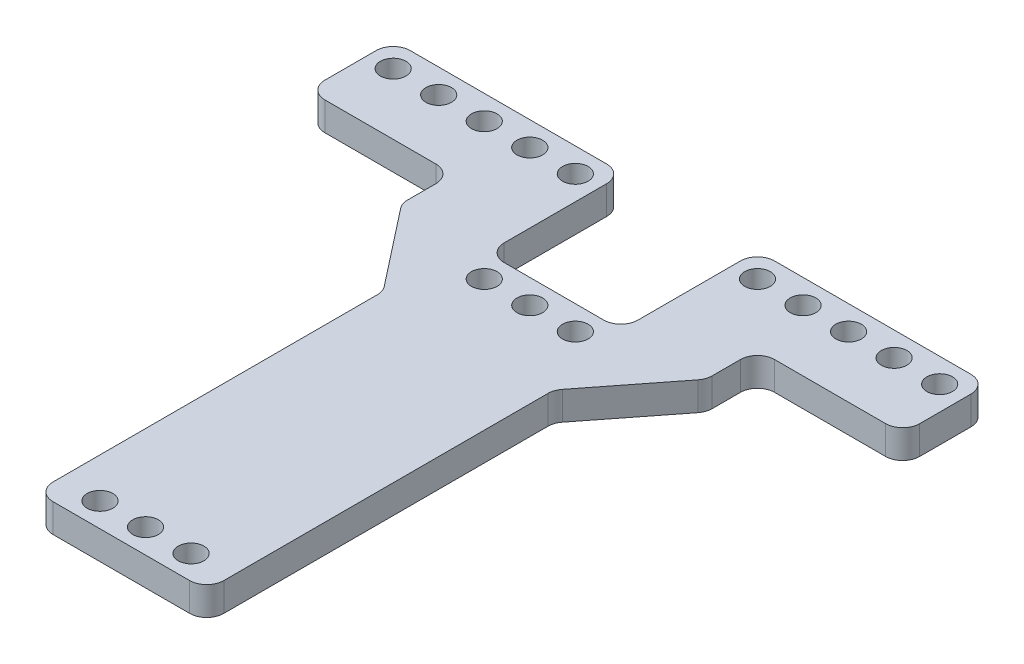
from build123d import *

# Parameters (mm, degrees)
SKETCH_2_R      = 2.25
EXTRUDE_1_DEPTH = 5
FILLET_1_R      = 3


with BuildPart() as part:
    # 草图2 → 凸台-拉伸1 (new body)
    with BuildSketch(Plane(origin=(0, 0, 0), x_dir=(1, 0, 0), z_dir=(0, 1, 0))):
        Polygon((-11.75, 50), (-52.25, 50), (-52.25, 35), (-26.75, 35), (-26.75, 26), (-15, 11), (-15, -50), (15, -50), (15, 11), (26.75, 26), (26.75, 35), (52.25, 35), (52.25, 50), (11.75, 50), (11.75, 26), (-11.75, 26), align=None)
        with Locations(Location((-8, -45.75, 0), (0, 0, 270))):
            Circle(SKETCH_2_R, mode=Mode.SUBTRACT)
        with Locations(Location((0, -45.75, 0), (0, 0, 270))):
            Circle(SKETCH_2_R, mode=Mode.SUBTRACT)
        with Locations(Location((8, -45.75, 0), (0, 0, 270))):
            Circle(SKETCH_2_R, mode=Mode.SUBTRACT)
        with Locations(Location((-8, 21.75, 0), (0, 0, 270))):
            Circle(SKETCH_2_R, mode=Mode.SUBTRACT)
        with Locations(Location((-48, 45.75, 0), (0, 0, 270))):
            Circle(SKETCH_2_R, mode=Mode.SUBTRACT)
        with Locations(Location((-40, 45.75, 0), (0, 0, 270))):
            Circle(SKETCH_2_R, mode=Mode.SUBTRACT)
        with Locations(Location((-32, 45.75, 0), (0, 0, 270))):
            Circle(SKETCH_2_R, mode=Mode.SUBTRACT)
        with Locations(Location((-24, 45.75, 0), (0, 0, 270))):
            Circle(SKETCH_2_R, mode=Mode.SUBTRACT)
        with Locations(Location((-16, 45.75, 0), (0, 0, 270))):
            Circle(SKETCH_2_R, mode=Mode.SUBTRACT)
        with Locations(Location((0, 21.75, 0), (0, 0, 270))):
            Circle(SKETCH_2_R, mode=Mode.SUBTRACT)
        with Locations(Location((8, 21.75, 0), (0, 0, 270))):
            Circle(SKETCH_2_R, mode=Mode.SUBTRACT)
        with Locations(Location((16, 45.75, 0), (0, 0, 270))):
            Circle(SKETCH_2_R, mode=Mode.SUBTRACT)
        with Locations(Location((24, 45.75, 0), (0, 0, 270))):
            Circle(SKETCH_2_R, mode=Mode.SUBTRACT)
        with Locations(Location((32, 45.75, 0), (0, 0, 270))):
            Circle(SKETCH_2_R, mode=Mode.SUBTRACT)
        with Locations(Location((40, 45.75, 0), (0, 0, 270))):
            Circle(SKETCH_2_R, mode=Mode.SUBTRACT)
        with Locations(Location((48, 45.75, 0), (0, 0, 270))):
            Circle(SKETCH_2_R, mode=Mode.SUBTRACT)
    extrude(amount=EXTRUDE_1_DEPTH)

    # 圆角1
    fillet_1_edges = [part.edges().sort_by_distance(p)[0] for p in [
        (15, 2.5, -11),
        (15, 2.5, 50),
        (-15, 2.5, 50),
        (-15, 2.5, -11),
        (-26.75, 2.5, -26),
        (-26.75, 2.5, -35),
        (-52.25, 2.5, -35),
        (-52.25, 2.5, -50),
        (-11.75, 2.5, -50),
        (-11.75, 2.5, -26),
        (11.75, 2.5, -26),
        (11.75, 2.5, -50),
        (52.25, 2.5, -50),
        (52.25, 2.5, -35),
        (26.75, 2.5, -35),
        (26.75, 2.5, -26),
    ]]
    fillet(fillet_1_edges, radius=FILLET_1_R)


solid = part.part
